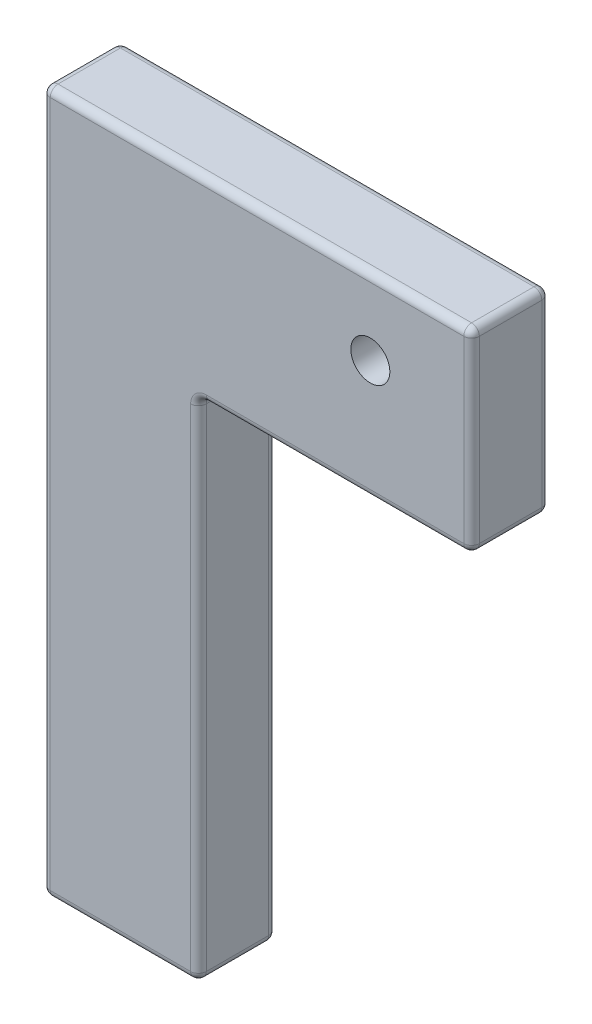
from build123d import *

# Parameters (mm, degrees)
SKETCH2_R           = 2.499990149
BOSS_EXTRUDE1_DEPTH = 10
FILLET1_R           = 1


with BuildPart() as part:
    # Sketch2 → Boss-Extrude1 (new body)
    with BuildSketch(Plane.XY):
        Polygon((0, 0), (0, 90), (55, 90), (55, 65), (20, 65), (20, 0), align=None)
        with Locations((42.025587792, 80.329294261)):
            Circle(SKETCH2_R, mode=Mode.SUBTRACT)
    extrude(amount=BOSS_EXTRUDE1_DEPTH)

    # Fillet1
    fillet1_edges = [part.edges().sort_by_distance(p)[0] for p in [
        (0, 0, 5),
        (0, 90, 5),
        (55, 90, 5),
        (55, 65, 5),
        (20, 65, 5),
        (20, 0, 5),
        (37.5, 65, 10),
        (55, 77.5, 10),
        (27.5, 90, 10),
        (0, 45, 10),
        (10, 0, 10),
        (0, 45, 0),
        (27.5, 90, 0),
        (55, 77.5, 0),
        (37.5, 65, 0),
        (20, 32.5, 0),
        (10, 0, 0),
        (20, 32.5, 10),
    ]]
    fillet(fillet1_edges, radius=FILLET1_R)


solid = part.part
